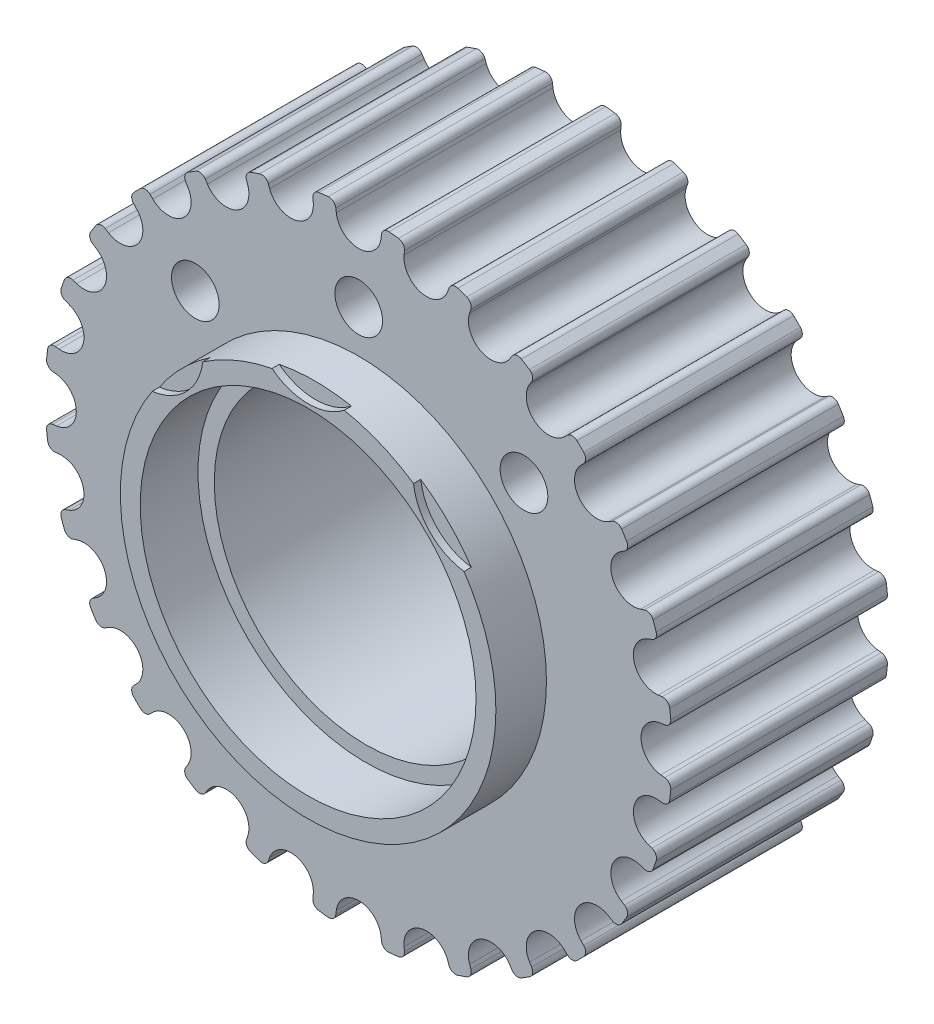
from build123d import *

# Parameters (mm, degrees)
SKETCH_2_R           = 10.5
EXTRUDE_1_DEPTH      = 15
EXTRUDE_2_DEPTH      = 3.5
EXTRUDE_2_DEPTH_BACK = 19.5
SKETCH_12_R          = 13
SKETCH_12_R_2        = 11.625
HOLE_WIZARD_M4_1_D   = 3.3
CUT_EXTRUDE_START    = -0.5
SKETCH_14_R          = 11.625
SKETCH_14_R_2        = 10.5
CUT_EXTRUDE_1_DEPTH  = 0.5
CUT_EXTRUDE_START_2  = 3.5
SKETCH_15_R          = 4.05
CUT_EXTRUDE_2_DEPTH  = 0.5
CUT_EXTRUDE_START_3  = -18
SKETCH_15_2_R        = 4.05
CUT_EXTRUDE_3_DEPTH  = 1.5
EXTRUDE_START        = 0.5
SKETCH_16_R          = 11.625
SKETCH_16_R_2        = 10.5
EXTRUDE_3_DEPTH      = 0.5


with BuildPart() as part:
    # 草图2 → 凸台-拉伸1 (new body)
    with BuildSketch(Plane.XY):
        with BuildLine():
            Line((1.331903556, 20.780403486), (1.298918642, 20.511762921))
            ThreePointArc((1.298918642, 20.511762921), (-0.249453355, 19.141879097), (-1.797825351, 20.511762921))
            Line((-1.797825351, 20.511762921), (-1.830810265, 20.780403486))
            ThreePointArc((-1.830810265, 20.780403486), (-2.006994407, 21.096415396), (-2.353762187, 21.19964565))
            ThreePointArc((-2.353762187, 21.19964565), (-2.679978202, 21.165383749), (-3.00563929, 21.12619674))
            ThreePointArc((-3.00563929, 21.12619674), (-3.320741986, 20.948391594), (-3.422189558, 20.601098103))
            Line((-3.422189558, 20.601098103), (-3.394569322, 20.331853084))
            ThreePointArc((-3.394569322, 20.331853084), (-4.599292572, 18.651769924), (-6.413671477, 19.642762718))
            Line((-6.413671477, 19.642762718), (-6.50560754, 19.897328069))
            ThreePointArc((-6.50560754, 19.897328069), (-6.747693643, 20.166212241), (-7.108738124, 20.189691206))
            ThreePointArc((-7.108738124, 20.189691206), (-7.419151232, 20.083698431), (-7.727927386, 19.973027513))
            ThreePointArc((-7.727927386, 19.973027513), (-7.995564432, 19.729563367), (-8.01718843, 19.36840304))
            Line((-8.01718843, 19.36840304), (-7.930348038, 19.112054636))
            ThreePointArc((-7.930348038, 19.112054636), (-8.731012687, 17.206018527), (-10.720417968, 17.768427773))
            Line((-10.720417968, 17.768427773), (-10.866695121, 17.996152941))
            ThreePointArc((-10.866695121, 17.996152941), (-11.162543977, 18.2044264), (-11.51976088, 18.146976743))
            ThreePointArc((-11.51976088, 18.146976743), (-11.798805672, 17.974568014), (-12.075213567, 17.797962688))
            ThreePointArc((-12.075213567, 17.797962688), (-12.281964525, 17.501047851), (-12.222680631, 17.144130775))
            Line((-12.222680631, 17.144130775), (-12.080974622, 16.913533367))
            ThreePointArc((-12.080974622, 16.913533367), (-12.437432001, 14.877120916), (-14.502106569, 14.982745068))
            Line((-14.502106569, 14.982745068), (-14.695389866, 15.172210962))
            ThreePointArc((-14.695389866, 15.172210962), (-15.030166378, 15.309430006), (-15.365643356, 15.173932493))
            ThreePointArc((-15.365643356, 15.173932493), (-15.599327361, 14.943753103), (-15.829506751, 14.710069098))
            ThreePointArc((-15.829506751, 14.710069098), (-15.965004264, 14.37459212), (-15.82778522, 14.039815608))
            Line((-15.82778522, 14.039815608), (-15.638319326, 13.846532311))
            ThreePointArc((-15.638319326, 13.846532311), (-15.532695174, 11.781857744), (-17.569107624, 11.425400364))
            Line((-17.569107624, 11.425400364), (-17.799705033, 11.567106373))
            ThreePointArc((-17.799705033, 11.567106373), (-18.156622109, 11.626390267), (-18.453536946, 11.41963931))
            ThreePointArc((-18.453536946, 11.41963931), (-18.630142271, 11.143231414), (-18.802551001, 10.864186622))
            ThreePointArc((-18.802551001, 10.864186622), (-18.860000658, 10.506969719), (-18.651727199, 10.211120863))
            Line((-18.651727199, 10.211120863), (-18.424002031, 10.06484371))
            ThreePointArc((-18.424002031, 10.06484371), (-17.861592784, 8.075438429), (-19.767628894, 7.27477378))
            Line((-19.767628894, 7.27477378), (-20.023977298, 7.361614172))
            ThreePointArc((-20.023977298, 7.361614172), (-20.385137624, 7.339990175), (-20.628601771, 7.072353128))
            ThreePointArc((-20.628601771, 7.072353128), (-20.739272689, 6.763576974), (-20.845265464, 6.453163866))
            ThreePointArc((-20.845265464, 6.453163866), (-20.821786499, 6.092119385), (-20.552902327, 5.850033282))
            Line((-20.552902327, 5.850033282), (-20.298336976, 5.75809722))
            ThreePointArc((-20.298336976, 5.75809722), (-19.307344182, 3.943718314), (-20.987427341, 2.738995064))
            Line((-20.987427341, 2.738995064), (-21.25667236, 2.7666153))
            ThreePointArc((-21.25667236, 2.7666153), (-21.603965852, 2.665167728), (-21.781770998, 2.350065032))
            ThreePointArc((-21.781770998, 2.350065032), (-21.820958007, 2.024403944), (-21.855219907, 1.69818793))
            ThreePointArc((-21.855219907, 1.69818793), (-21.751989654, 1.351420149), (-21.435977744, 1.175236007))
            Line((-21.435977744, 1.175236007), (-21.167337179, 1.142251093))
            ThreePointArc((-21.167337179, 1.142251093), (-19.797453355, -0.406120903), (-21.167337179, -1.9544929))
            Line((-21.167337179, -1.9544929), (-21.435977744, -1.987477814))
            ThreePointArc((-21.435977744, -1.987477814), (-21.751989654, -2.163661955), (-21.855219907, -2.510429736))
            ThreePointArc((-21.855219907, -2.510429736), (-21.820958007, -2.83664575), (-21.781770998, -3.162306838))
            ThreePointArc((-21.781770998, -3.162306838), (-21.603965852, -3.477409534), (-21.25667236, -3.578857107))
            Line((-21.25667236, -3.578857107), (-20.987427341, -3.55123687))
            ThreePointArc((-20.987427341, -3.55123687), (-19.307344182, -4.75596012), (-20.298336976, -6.570339026))
            Line((-20.298336976, -6.570339026), (-20.552902327, -6.662275089))
            ThreePointArc((-20.552902327, -6.662275089), (-20.821786499, -6.904361192), (-20.845265464, -7.265405672))
            ThreePointArc((-20.845265464, -7.265405672), (-20.739272689, -7.57581878), (-20.628601771, -7.884594935))
            ThreePointArc((-20.628601771, -7.884594935), (-20.385137624, -8.152231981), (-20.023977298, -8.173855979))
            Line((-20.023977298, -8.173855979), (-19.767628894, -8.087015586))
            ThreePointArc((-19.767628894, -8.087015586), (-17.861592784, -8.887680235), (-18.424002031, -10.877085516))
            Line((-18.424002031, -10.877085516), (-18.651727199, -11.023362669))
            ThreePointArc((-18.651727199, -11.023362669), (-18.860000658, -11.319211525), (-18.802551001, -11.676428428))
            ThreePointArc((-18.802551001, -11.676428428), (-18.630142271, -11.95547322), (-18.453536946, -12.231881116))
            ThreePointArc((-18.453536946, -12.231881116), (-18.156622109, -12.438632073), (-17.799705033, -12.379348179))
            Line((-17.799705033, -12.379348179), (-17.569107624, -12.237642171))
            ThreePointArc((-17.569107624, -12.237642171), (-15.532695174, -12.59409955), (-15.638319326, -14.658774118))
            Line((-15.638319326, -14.658774118), (-15.82778522, -14.852057414))
            ThreePointArc((-15.82778522, -14.852057414), (-15.965004264, -15.186833926), (-15.829506751, -15.522310905))
            ThreePointArc((-15.829506751, -15.522310905), (-15.599327361, -15.755994909), (-15.365643356, -15.9861743))
            ThreePointArc((-15.365643356, -15.9861743), (-15.030166378, -16.121671812), (-14.695389866, -15.984452768))
            Line((-14.695389866, -15.984452768), (-14.502106569, -15.794986874))
            ThreePointArc((-14.502106569, -15.794986874), (-12.437432001, -15.689362722), (-12.080974622, -17.725775173))
            Line((-12.080974622, -17.725775173), (-12.222680631, -17.956372582))
            ThreePointArc((-12.222680631, -17.956372582), (-12.281964525, -18.313289657), (-12.075213567, -18.610204494))
            ThreePointArc((-12.075213567, -18.610204494), (-11.798805672, -18.78680982), (-11.51976088, -18.95921855))
            ThreePointArc((-11.51976088, -18.95921855), (-11.162543977, -19.016668206), (-10.866695121, -18.808394748))
            Line((-10.866695121, -18.808394748), (-10.720417968, -18.58066958))
            ThreePointArc((-10.720417968, -18.58066958), (-8.731012687, -18.018260333), (-7.930348038, -19.924296443))
            Line((-7.930348038, -19.924296443), (-8.01718843, -20.180644846))
            ThreePointArc((-8.01718843, -20.180644846), (-7.995564432, -20.541805173), (-7.727927386, -20.785269319))
            ThreePointArc((-7.727927386, -20.785269319), (-7.419151232, -20.895940238), (-7.108738124, -21.001933013))
            ThreePointArc((-7.108738124, -21.001933013), (-6.747693643, -20.978454047), (-6.50560754, -20.709569876))
            Line((-6.50560754, -20.709569876), (-6.413671477, -20.455004524))
            ThreePointArc((-6.413671477, -20.455004524), (-4.599292572, -19.464011731), (-3.394569322, -21.14409489))
            Line((-3.394569322, -21.14409489), (-3.422189558, -21.413339909))
            ThreePointArc((-3.422189558, -21.413339909), (-3.320741986, -21.7606334), (-3.00563929, -21.938438546))
            ThreePointArc((-3.00563929, -21.938438546), (-2.679978202, -21.977625556), (-2.353762187, -22.011887456))
            ThreePointArc((-2.353762187, -22.011887456), (-2.006994407, -21.908657202), (-1.830810265, -21.592645292))
            Line((-1.830810265, -21.592645292), (-1.797825351, -21.324004727))
            ThreePointArc((-1.797825351, -21.324004727), (-0.249453355, -19.954120903), (1.298918642, -21.324004727))
            Line((1.298918642, -21.324004727), (1.331903556, -21.592645292))
            ThreePointArc((1.331903556, -21.592645292), (1.508087698, -21.908657202), (1.854855478, -22.011887456))
            ThreePointArc((1.854855478, -22.011887456), (2.181071493, -21.977625556), (2.506732581, -21.938438546))
            ThreePointArc((2.506732581, -21.938438546), (2.821835276, -21.7606334), (2.923282849, -21.413339909))
            Line((2.923282849, -21.413339909), (2.895662612, -21.14409489))
            ThreePointArc((2.895662612, -21.14409489), (4.100385862, -19.464011731), (5.914764768, -20.455004524))
            Line((5.914764768, -20.455004524), (6.006700831, -20.709569876))
            ThreePointArc((6.006700831, -20.709569876), (6.248786934, -20.978454047), (6.609831415, -21.001933013))
            ThreePointArc((6.609831415, -21.001933013), (6.920244522, -20.895940238), (7.229020677, -20.785269319))
            ThreePointArc((7.229020677, -20.785269319), (7.496657723, -20.541805173), (7.518281721, -20.180644846))
            Line((7.518281721, -20.180644846), (7.431441329, -19.924296443))
            ThreePointArc((7.431441329, -19.924296443), (8.232105978, -18.018260333), (10.221511258, -18.58066958))
            Line((10.221511258, -18.58066958), (10.367788412, -18.808394748))
            ThreePointArc((10.367788412, -18.808394748), (10.663637267, -19.016668206), (11.020854171, -18.95921855))
            ThreePointArc((11.020854171, -18.95921855), (11.299898962, -18.78680982), (11.576306858, -18.610204494))
            ThreePointArc((11.576306858, -18.610204494), (11.783057816, -18.313289657), (11.723773921, -17.956372582))
            Line((11.723773921, -17.956372582), (11.582067913, -17.725775173))
            ThreePointArc((11.582067913, -17.725775173), (11.938525292, -15.689362722), (14.00319986, -15.794986874))
            Line((14.00319986, -15.794986874), (14.196483156, -15.984452768))
            ThreePointArc((14.196483156, -15.984452768), (14.531259668, -16.121671812), (14.866736647, -15.9861743))
            ThreePointArc((14.866736647, -15.9861743), (15.100420651, -15.755994909), (15.330600042, -15.522310905))
            ThreePointArc((15.330600042, -15.522310905), (15.466097554, -15.186833926), (15.32887851, -14.852057414))
            Line((15.32887851, -14.852057414), (15.139412616, -14.658774118))
            ThreePointArc((15.139412616, -14.658774118), (15.033788465, -12.59409955), (17.070200915, -12.237642171))
            Line((17.070200915, -12.237642171), (17.300798324, -12.379348179))
            ThreePointArc((17.300798324, -12.379348179), (17.657715399, -12.438632073), (17.954630236, -12.231881116))
            ThreePointArc((17.954630236, -12.231881116), (18.131235562, -11.95547322), (18.303644292, -11.676428428))
            ThreePointArc((18.303644292, -11.676428428), (18.361093948, -11.319211525), (18.15282049, -11.023362669))
            Line((18.15282049, -11.023362669), (17.925095322, -10.877085516))
            ThreePointArc((17.925095322, -10.877085516), (17.362686075, -8.887680235), (19.268722185, -8.087015586))
            Line((19.268722185, -8.087015586), (19.525070588, -8.173855979))
            ThreePointArc((19.525070588, -8.173855979), (19.886230915, -8.152231981), (20.129695061, -7.884594935))
            ThreePointArc((20.129695061, -7.884594935), (20.24036598, -7.57581878), (20.346358755, -7.265405672))
            ThreePointArc((20.346358755, -7.265405672), (20.32287979, -6.904361192), (20.053995618, -6.662275089))
            Line((20.053995618, -6.662275089), (19.799430267, -6.570339026))
            ThreePointArc((19.799430267, -6.570339026), (18.808437473, -4.75596012), (20.488520632, -3.55123687))
            Line((20.488520632, -3.55123687), (20.757765651, -3.578857107))
            ThreePointArc((20.757765651, -3.578857107), (21.105059142, -3.477409534), (21.282864289, -3.162306838))
            ThreePointArc((21.282864289, -3.162306838), (21.322051298, -2.83664575), (21.356313198, -2.510429736))
            ThreePointArc((21.356313198, -2.510429736), (21.253082944, -2.163661955), (20.937071035, -1.987477814))
            Line((20.937071035, -1.987477814), (20.66843047, -1.9544929))
            ThreePointArc((20.66843047, -1.9544929), (19.298546645, -0.406120903), (20.66843047, 1.142251093))
            Line((20.66843047, 1.142251093), (20.937071035, 1.175236007))
            ThreePointArc((20.937071035, 1.175236007), (21.253082944, 1.351420149), (21.356313198, 1.69818793))
            ThreePointArc((21.356313198, 1.69818793), (21.322051298, 2.024403944), (21.282864289, 2.350065032))
            ThreePointArc((21.282864289, 2.350065032), (21.105059142, 2.665167728), (20.757765651, 2.7666153))
            Line((20.757765651, 2.7666153), (20.488520632, 2.738995064))
            ThreePointArc((20.488520632, 2.738995064), (18.808437473, 3.943718314), (19.799430267, 5.75809722))
            Line((19.799430267, 5.75809722), (20.053995618, 5.850033282))
            ThreePointArc((20.053995618, 5.850033282), (20.32287979, 6.092119385), (20.346358755, 6.453163866))
            ThreePointArc((20.346358755, 6.453163866), (20.24036598, 6.763576974), (20.129695061, 7.072353128))
            ThreePointArc((20.129695061, 7.072353128), (19.886230915, 7.339990175), (19.525070588, 7.361614172))
            Line((19.525070588, 7.361614172), (19.268722185, 7.27477378))
            ThreePointArc((19.268722185, 7.27477378), (17.362686075, 8.075438429), (17.925095322, 10.06484371))
            Line((17.925095322, 10.06484371), (18.15282049, 10.211120863))
            ThreePointArc((18.15282049, 10.211120863), (18.361093948, 10.506969719), (18.303644292, 10.864186622))
            ThreePointArc((18.303644292, 10.864186622), (18.131235562, 11.143231414), (17.954630236, 11.41963931))
            ThreePointArc((17.954630236, 11.41963931), (17.657715399, 11.626390267), (17.300798324, 11.567106373))
            Line((17.300798324, 11.567106373), (17.070200915, 11.425400364))
            ThreePointArc((17.070200915, 11.425400364), (15.033788465, 11.781857744), (15.139412616, 13.846532311))
            Line((15.139412616, 13.846532311), (15.32887851, 14.039815608))
            ThreePointArc((15.32887851, 14.039815608), (15.466097554, 14.37459212), (15.330600042, 14.710069098))
            ThreePointArc((15.330600042, 14.710069098), (15.100420651, 14.943753103), (14.866736647, 15.173932493))
            ThreePointArc((14.866736647, 15.173932493), (14.531259668, 15.309430006), (14.196483156, 15.172210962))
            Line((14.196483156, 15.172210962), (14.00319986, 14.982745068))
            ThreePointArc((14.00319986, 14.982745068), (11.938525292, 14.877120916), (11.582067913, 16.913533367))
            Line((11.582067913, 16.913533367), (11.723773921, 17.144130775))
            ThreePointArc((11.723773921, 17.144130775), (11.783057816, 17.501047851), (11.576306858, 17.797962688))
            ThreePointArc((11.576306858, 17.797962688), (11.299898962, 17.974568014), (11.020854171, 18.146976743))
            ThreePointArc((11.020854171, 18.146976743), (10.663637267, 18.2044264), (10.367788412, 17.996152941))
            Line((10.367788412, 17.996152941), (10.221511258, 17.768427773))
            ThreePointArc((10.221511258, 17.768427773), (8.232105978, 17.206018527), (7.431441329, 19.112054636))
            Line((7.431441329, 19.112054636), (7.518281721, 19.36840304))
            ThreePointArc((7.518281721, 19.36840304), (7.496657723, 19.729563367), (7.229020677, 19.973027513))
            ThreePointArc((7.229020677, 19.973027513), (6.920244522, 20.083698431), (6.609831415, 20.189691206))
            ThreePointArc((6.609831415, 20.189691206), (6.248786934, 20.166212241), (6.006700831, 19.897328069))
            Line((6.006700831, 19.897328069), (5.914764768, 19.642762718))
            ThreePointArc((5.914764768, 19.642762718), (4.100385862, 18.651769924), (2.895662612, 20.331853084))
            Line((2.895662612, 20.331853084), (2.923282849, 20.601098103))
            ThreePointArc((2.923282849, 20.601098103), (2.821835276, 20.948391594), (2.506732581, 21.12619674))
            ThreePointArc((2.506732581, 21.12619674), (2.181071493, 21.165383749), (1.854855478, 21.19964565))
            ThreePointArc((1.854855478, 21.19964565), (1.508087698, 21.096415396), (1.331903556, 20.780403486))
        make_face()
        with Locations((-0.245789015, -0.367741944)):
            Circle(SKETCH_2_R, mode=Mode.SUBTRACT)
    extrude(amount=EXTRUDE_1_DEPTH)


with BuildPart() as part_1:
    # Move Body 1: moved
    add(part.part.moved(Location((-21.775119277, 0, 0))))

    # 草图12 → 凸台-拉伸2 (add, two sides: drawn at the far end of the back side and taken through both)
    with BuildSketch(Plane.XY.offset(15).offset(-EXTRUDE_2_DEPTH_BACK)):
        with Locations((-22.024572632, -0.309578045)):
            Circle(SKETCH_12_R)
        with Locations((-22.024572632, -0.309578045)):
            Circle(SKETCH_12_R_2, mode=Mode.SUBTRACT)
    extrude(amount=EXTRUDE_2_DEPTH + EXTRUDE_2_DEPTH_BACK)

    # M4 螺纹孔1 (through all)
    with Locations(Plane(origin=(-33.334616791, 10.945966555, 15), x_dir=(1, 0, 0), z_dir=(0, 0, 1))):
        with Locations((0, 0), (11.313708499, 4.686291501), (22.755337645, -0.129383643)):
            Hole(HOLE_WIZARD_M4_1_D / 2)

    # 草图14 → 切除-拉伸1 (cut)
    with BuildSketch(Plane.XY.offset(15).offset(CUT_EXTRUDE_START)):
        with Locations((-22.024572632, -0.309578045)):
            Circle(SKETCH_14_R)
        with Locations((-22.020908292, -0.367741944)):
            Circle(SKETCH_14_R_2, mode=Mode.SUBTRACT)
    extrude(amount=CUT_EXTRUDE_1_DEPTH, mode=Mode.SUBTRACT)

    # 草图15 → 切除-拉伸2 (cut)
    with BuildSketch(Plane.XY.offset(15).offset(CUT_EXTRUDE_START_2)):
        with Locations((-22.020908292, 15.632258056)):
            Circle(SKETCH_15_R)
        with Locations((-10.707199793, 10.945966555)):
            Circle(SKETCH_15_R)
        with Locations((-33.334616791, 10.945966555)):
            Circle(SKETCH_15_R)
    extrude(amount=-CUT_EXTRUDE_2_DEPTH, mode=Mode.SUBTRACT)

    # 草图15<2> → 切除-拉伸3 (cut)
    with BuildSketch(Plane.XY.offset(15).offset(CUT_EXTRUDE_START_3)):
        with Locations((-22.020908292, 15.632258056)):
            Circle(SKETCH_15_2_R)
        with Locations((-10.707199793, 10.945966555)):
            Circle(SKETCH_15_2_R)
        with Locations((-33.334616791, 10.945966555)):
            Circle(SKETCH_15_2_R)
    extrude(amount=-CUT_EXTRUDE_3_DEPTH, mode=Mode.SUBTRACT)

    # 草图16 → 凸台-拉伸3 (add)
    with BuildSketch(Plane(origin=(0, 0, 0), x_dir=(-1, 0, 0), z_dir=(0, 0, -1)).offset(EXTRUDE_START)):
        with Locations(Location((22.024572632, -0.309578045, 0), (0, 0, 180))):
            Circle(SKETCH_16_R)
        with Locations((22.020908292, -0.367741944)):
            Circle(SKETCH_16_R_2, mode=Mode.SUBTRACT)
    extrude(amount=-EXTRUDE_3_DEPTH)


solid = part_1.part
